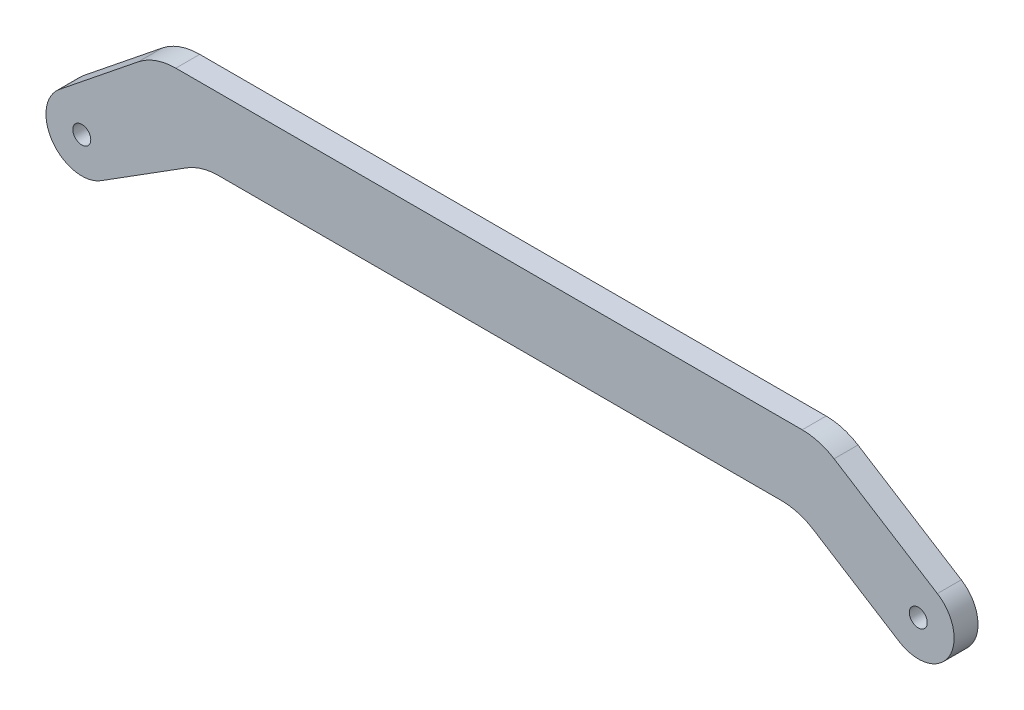
from build123d import *

# Parameters (mm, degrees)
SCHIZZO1_R                   = 1.5
ESTRUSIONE_ESTRUSIONE1_DEPTH = 4


with BuildPart() as part:
    # Schizzo1 → Estrusione-Estrusione1 (new body)
    with BuildSketch(Plane.XY):
        with BuildLine():
            Line((-3.757019077, 4.678120099), (9.474796834, 15.30465036))
            ThreePointArc((9.474796834, 15.30465036), (12.41750963, 16.940934337), (15.736495295, 17.507783529))
            Line((15.736495295, 17.507783529), (120.577440721, 17.507783529))
            ThreePointArc((120.577440721, 17.507783529), (123.351342788, 17.115356965), (125.907534283, 15.968876995))
            Line((125.907534283, 15.968876995), (143.198056137, 5.076656079))
            ThreePointArc((143.198056137, 5.076656079), (145.076656079, -3.198056137), (136.801943863, -5.076656079))
            Line((136.801943863, -5.076656079), (122.442889956, 3.968876995))
            ThreePointArc((122.442889956, 3.968876995), (119.886698461, 5.115356965), (117.112796394, 5.507783529))
            Line((117.112796394, 5.507783529), (22.887203606, 5.507783529))
            ThreePointArc((22.887203606, 5.507783529), (20.113301539, 5.115356965), (17.557110044, 3.968876995))
            Line((17.557110044, 3.968876995), (3.198056137, -5.076656079))
            ThreePointArc((3.198056137, -5.076656079), (-4.885388875, -3.483242102), (-3.757019077, 4.678120099))
        make_face()
        Circle(SCHIZZO1_R, mode=Mode.SUBTRACT)
        with Locations((140, 0)):
            Circle(SCHIZZO1_R, mode=Mode.SUBTRACT)
    extrude(amount=ESTRUSIONE_ESTRUSIONE1_DEPTH)


solid = part.part
